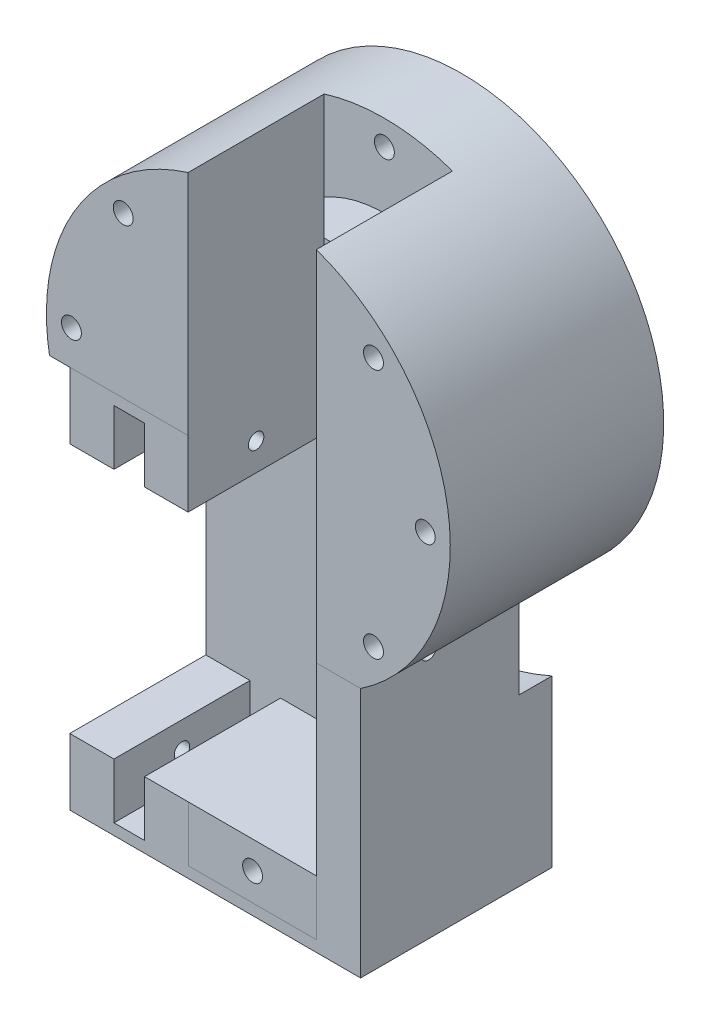
from build123d import *
from build123d.topology import SkipClean

# Parameters (mm, degrees)
ESQUISSE1_W              = 22.3
ESQUISSE1_H              = 43
ESQUISSE1_R              = 2.45
BOSS_EXTRU_1_DEPTH       = 5
BOSS_EXTRU_2_START       = -2.47
ESQUISSE2_R              = 2.45
ESQUISSE2_R_2            = 0.7
BOSS_EXTRU_2_DEPTH       = 2.47
ESQUISSE3_W              = 4
ESQUISSE3_H              = 5
ESQUISSE3_W_2            = 3.94
BOSS_EXTRU_3_DEPTH       = 12.3
ESQUISSE4_R              = 0.7
ENL_V_MAT_EXTRU_1_DEPTH  = 52.435201954
BOSS_EXTRU_4_DEPTH       = 1
ESQUISSE6_W              = 10.7
ESQUISSE6_H              = 12.3
BOSS_EXTRU_5_DEPTH       = 1
ESQUISSE7_R              = 0.7
BOSS_EXTRU_6_DEPTH       = 4
BOSS_EXTRU_7_DEPTH       = 2
BOSS_EXTRU_7_DEPTH_BACK  = 5
ESQUISSE10_R             = 18.258884917
ESQUISSE10_R_2           = 10.815915506
ESQUISSE11_R             = 25
ESQUISSE11_R_2           = 18.258884917
ENL_V_MAT_EXTRU_4_DEPTH  = 3
ESQUISSE13_W             = 11.54
ESQUISSE13_H             = 5
BOSS_EXTRU_14_DEPTH      = 12.3
BOSS_EXTRU_15_DEPTH      = 12.3
BOSS_EXTRU_19_DEPTH      = 12.3
BOSS_EXTRU_19_DEPTH_BACK = 1
ESQUISSE16_R             = 0.9
ENL_V_MAT_EXTRU_5_DEPTH  = 54.89147246
ESQUISSE17_R             = 0.9
ENL_V_MAT_EXTRU_6_DEPTH  = 54.891424113


with BuildPart() as part:
    # Esquisse1 → Boss.-Extru.1 (new body)
    with BuildSketch(Plane.XY):
        with Locations((-11.15, -21.5)):
            Rectangle(ESQUISSE1_W, ESQUISSE1_H)
        with Locations((-6.15, -6.15)):
            Circle(ESQUISSE1_R, mode=Mode.SUBTRACT)
    extrude(amount=BOSS_EXTRU_1_DEPTH)

    # Esquisse2 → Boss.-Extru.2 (add)
    with BuildSketch(Plane.XY.offset(5).offset(BOSS_EXTRU_2_START)):
        with Locations((-6.15, -6.15)):
            Circle(ESQUISSE2_R)
        with Locations((-6.15, -6.15)):
            Circle(ESQUISSE2_R_2, mode=Mode.SUBTRACT)
    extrude(amount=BOSS_EXTRU_2_DEPTH)

    # Esquisse3 → Boss.-Extru.3 (add)
    with BuildSketch(Plane.XY.offset(5)):
        with Locations((-20.3, -40.5)):
            Rectangle(ESQUISSE3_W, ESQUISSE3_H)
        with Locations((-13.54, -40.5)):
            Rectangle(ESQUISSE3_W, ESQUISSE3_H)
        with Locations((-20.3, -12.82)):
            Rectangle(ESQUISSE3_W, ESQUISSE3_H)
        with Locations((-13.57, -12.82)):
            Rectangle(ESQUISSE3_W_2, ESQUISSE3_H)
    extrude(amount=BOSS_EXTRU_3_DEPTH)

    # Esquisse4 → Enlèv. mat.-Extru.1 (cut, through all)
    with BuildSketch(Plane.ZY.offset(22.3)):
        with Locations((11.15, -12.82)):
            Circle(ESQUISSE4_R)
        with Locations((11.15, -40.42)):
            Circle(ESQUISSE4_R)
    extrude(amount=-ENL_V_MAT_EXTRU_1_DEPTH, mode=Mode.SUBTRACT)

    # Esquisse5 → Boss.-Extru.4 (add)
    with BuildSketch(Plane.XZ.offset(43)):
        Polygon((-22.3, 17.3), (-11.54, 17.3), (0, 17.3), (0, 5), (0, 0), (-22.3, 0), align=None)
    extrude(amount=BOSS_EXTRU_4_DEPTH)

    # Esquisse6 → Boss.-Extru.5 (add)
    with BuildSketch(Plane(origin=(0, -10.32, 0), x_dir=(1, 0, 0), z_dir=(0, 1, 0))):
        with Locations((-16.95, -11.15)):
            Rectangle(ESQUISSE6_W, ESQUISSE6_H)
    extrude(amount=BOSS_EXTRU_5_DEPTH)

    # Esquisse7 → Boss.-Extru.6 (add)
    with BuildSketch(Plane(origin=(0, 0, 0), x_dir=(0, 0, -1), z_dir=(1, 0, 0))):
        Polygon((-5, -9.32), (0, -9.32), (0, -15.32), (0, -27.62), (0, -44), (-17.3, -44), (-17.3, -9.32), align=None)
        with Locations(Location((-11.15, -21.47, 0), (0, 0, 90))):
            Circle(ESQUISSE7_R, mode=Mode.SUBTRACT)
    extrude(amount=BOSS_EXTRU_6_DEPTH)

    # Esquisse10 → Boss.-Extru.7 (add, two sides: drawn at the far end of the back side and taken through both)
    with BuildSketch(Plane(origin=(0, 0, 0), x_dir=(-1, 0, 0), z_dir=(0, 0, -1)).offset(-BOSS_EXTRU_7_DEPTH_BACK)):
        with Locations((6.15, -6.15)):
            Circle(ESQUISSE10_R)
        with Locations((6.15, -6.15)):
            Circle(ESQUISSE10_R_2, mode=Mode.SUBTRACT)
    extrude(amount=BOSS_EXTRU_7_DEPTH + BOSS_EXTRU_7_DEPTH_BACK)

    # Esquisse11 → Enlèv. mat.-Extru.4 (cut)
    with BuildSketch(Plane(origin=(0, 0, 0), x_dir=(-1, 0, 0), z_dir=(0, 0, -1))):
        with Locations((6.15, -6.15)):
            Circle(ESQUISSE11_R)
        with Locations((6.15, -6.15)):
            Circle(ESQUISSE11_R_2, mode=Mode.SUBTRACT)
    extrude(amount=-ENL_V_MAT_EXTRU_4_DEPTH, mode=Mode.SUBTRACT)

    # Esquisse13 → Boss.-Extru.14 (add, through all)
    with BuildSketch(Plane.XY.offset(5)):
        with Locations((-5.77, -40.5)):
            Rectangle(ESQUISSE13_W, ESQUISSE13_H)
    extrude(amount=BOSS_EXTRU_14_DEPTH)

    # Esquisse14 → Boss.-Extru.15 (add, through all)
    with BuildSketch(Plane.XY.offset(5)):
        with BuildLine():
            Line((-11.6, 11.276542354), (-11.6, -9.32))
            Line((-11.6, -9.32), (-24.131601108, -9.32))
            ThreePointArc((-24.131601108, -9.32), (-21.748537491, 3.340653642), (-11.6, 11.276542354))
        make_face()
    extrude(amount=BOSS_EXTRU_15_DEPTH)

    # Esquisse15 → Boss.-Extru.19 (add, two sides: drawn at the far end of the back side and taken through both)
    with SkipClean():  # the faces are left unmerged after this step: merging them gives an invalid solid
        with BuildSketch(Plane.XY.offset(5).offset(-BOSS_EXTRU_19_DEPTH_BACK)):
            with BuildLine():
                Line((0, 11.041985878), (0, -21.327759335))
                Line((0, -21.327759335), (4, -21.327759335))
                ThreePointArc((4, -21.327759335), (11.971054089, -3.910741832), (0, 11.041985878))
            make_face()
        extrude(amount=BOSS_EXTRU_19_DEPTH + BOSS_EXTRU_19_DEPTH_BACK)

    # Esquisse16 → Enlèv. mat.-Extru.5 (cut, through all)
    with SkipClean():  # the faces are left unmerged after this step: merging them gives an invalid solid
        with BuildSketch(Plane.XY.offset(17.300185)):
            with Locations((9.85, -6.15)):
                Circle(ESQUISSE16_R)
            with Locations((5.163708499, -17.463708499)):
                Circle(ESQUISSE16_R)
            with Locations((-22.15, -6.15)):
                Circle(ESQUISSE16_R)
            with Locations((-17.463708499, 5.163708499)):
                Circle(ESQUISSE16_R)
            with Locations((-6.15, 9.85)):
                Circle(ESQUISSE16_R)
            with Locations((5.163708499, 5.163708499)):
                Circle(ESQUISSE16_R)
        extrude(amount=-ENL_V_MAT_EXTRU_5_DEPTH, mode=Mode.SUBTRACT)

    # Esquisse17 → Enlèv. mat.-Extru.6 (cut, through all)
    with SkipClean():  # the faces are left unmerged after this step: merging them gives an invalid solid
        with BuildSketch(Plane.XY.offset(17.30005)):
            with Locations((-5.77, -40.5)):
                Circle(ESQUISSE17_R)
        extrude(amount=-ENL_V_MAT_EXTRU_6_DEPTH, mode=Mode.SUBTRACT)


solid = part.part
